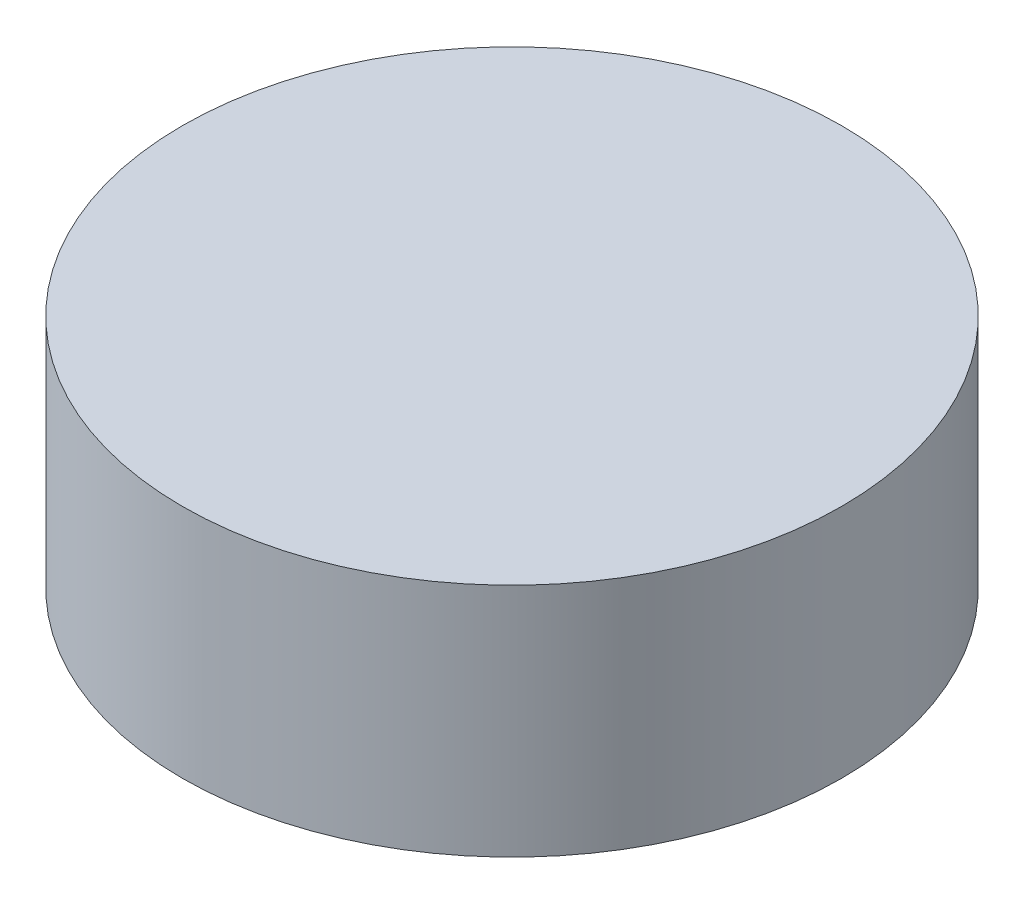
from build123d import *

# Parameters (mm, degrees)
SKETCH_1_R      = 7
EXTRUDE_1_DEPTH = 5


with BuildPart() as part:
    # 草图1 → 凸台-拉伸1 (new body)
    with BuildSketch(Plane(origin=(0, 0, 0), x_dir=(1, 0, 0), z_dir=(0, 1, 0))):
        with Locations(Location((0, 0, 0), (0, 0, 270))):
            Circle(SKETCH_1_R)
    extrude(amount=EXTRUDE_1_DEPTH)


solid = part.part
